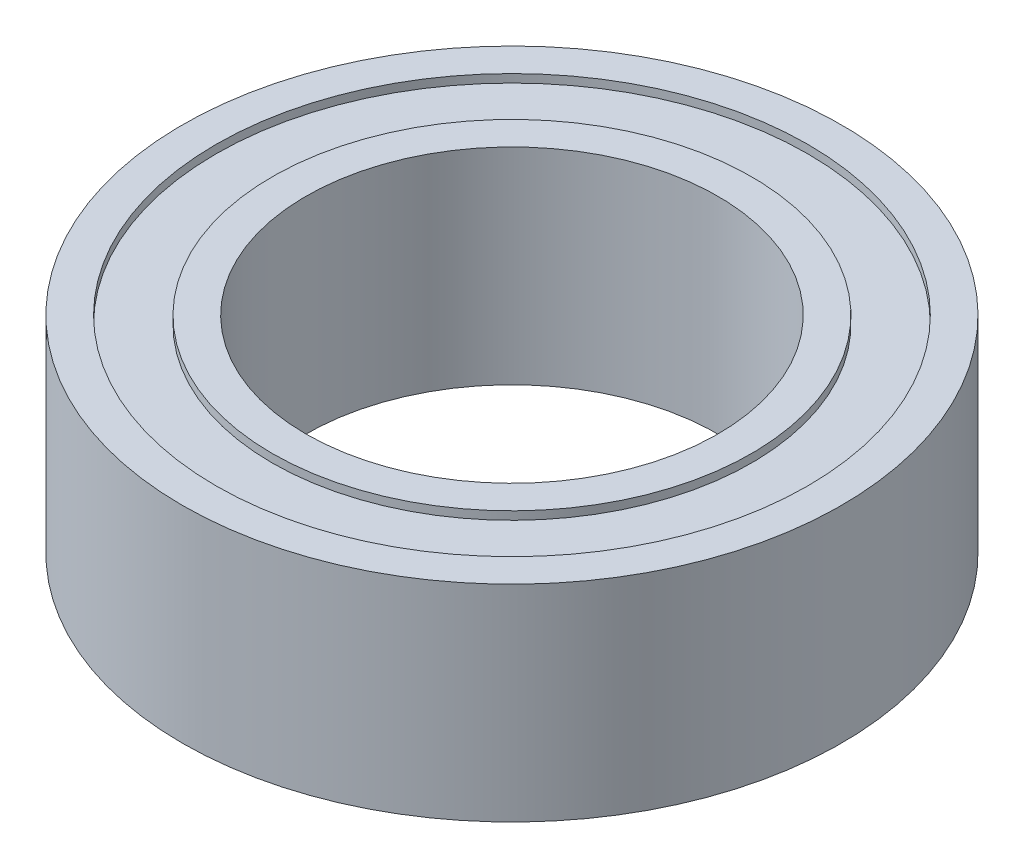
from build123d import *

# Parameters (mm, degrees)
SKETCH1_R           = 4
SKETCH1_R_2         = 2.5
BOSS_EXTRUDE1_DEPTH = 1.25
SKETCH2_R           = 3.590807055
SKETCH2_R_2         = 2.909192945
CUT_EXTRUDE1_DEPTH  = 0.1


with BuildPart() as part:
    # Sketch1 → Boss-Extrude1 (new body)
    with BuildSketch(Plane(origin=(0, 0, 0), x_dir=(1, 0, 0), z_dir=(0, 1, 0))):
        with Locations(Location((0, 0, 0), (0, 0, 270))):
            Circle(SKETCH1_R)
        with Locations(Location((0, 0, 0), (0, 0, 270))):
            Circle(SKETCH1_R_2, mode=Mode.SUBTRACT)
    extrude(amount=BOSS_EXTRUDE1_DEPTH)

    # Sketch2 → Cut-Extrude1 (cut)
    with BuildSketch(Plane(origin=(0, 1.25, 0), x_dir=(1, 0, 0), z_dir=(0, 1, 0))):
        with Locations(Location((0, 0, 0), (0, 0, 270))):
            Circle(SKETCH2_R)
        with Locations(Location((0, 0, 0), (0, 0, 270))):
            Circle(SKETCH2_R_2, mode=Mode.SUBTRACT)
    extrude(amount=-CUT_EXTRUDE1_DEPTH, mode=Mode.SUBTRACT)

    # Mirror1: part across plane


with BuildPart() as part_1:
    add(part.part)
    add(part.part.mirror(Plane.ZX))


solid = part_1.part
